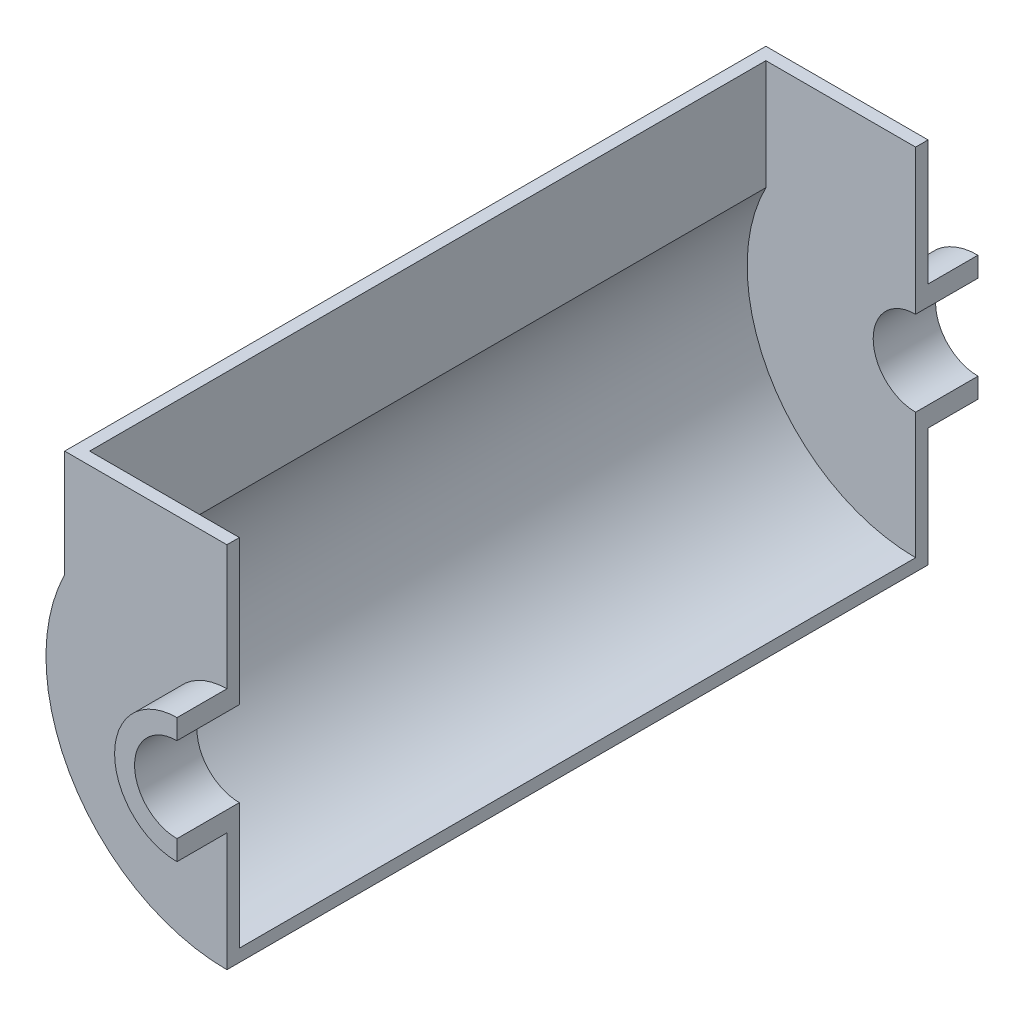
from build123d import *

# Parameters (mm, degrees)
BOSS_EXTRUDE1_DEPTH      = 20
BOSS_EXTRUDE1_DEPTH_BACK = 5
BOSS_EXTRUDE2_START      = -5
BOSS_EXTRUDE2_DEPTH      = 5
BOSS_EXTRUDE3_REACH      = 315.843


with BuildPart() as part:
    # Sketch1 → Boss-Extrude1 (new, two sides: drawn at the far end of the back side and taken through both)
    with BuildSketch(Plane.XY.offset(-BOSS_EXTRUDE1_DEPTH_BACK)):
        with BuildLine():
            Line((0, 25), (0, 17))
            ThreePointArc((0, 17), (-17, 0), (0, -17))
            Line((0, -17), (0, -25))
            ThreePointArc((0, -25), (-25, 0), (0, 25))
        make_face()
    extrude(amount=BOSS_EXTRUDE1_DEPTH + BOSS_EXTRUDE1_DEPTH_BACK)

    # Sketch2 → Boss-Extrude2 (add)
    with BuildSketch(Plane.XY.offset(BOSS_EXTRUDE2_START)):
        with BuildLine():
            Line((0, 25), (0, 75))
            Line((0, 75), (-65, 75))
            Line((-65, 75), (-65, 32.113081447))
            ThreePointArc((-65, 32.113081447), (-61.581037686, -38.262590053), (0, -72.5))
            Line((0, -72.5), (0, -25))
            ThreePointArc((0, -25), (-25, 0), (0, 25))
        make_face()
    extrude(amount=BOSS_EXTRUDE2_DEPTH)


with BuildPart() as body_2:
    # Mirror4: mirrored copy
    add(part.part.mirror(Plane.XY.offset(-140.5)))

    # Sketch3 → Boss-Extrude3 (add, up to next)
    with BuildSketch(Plane(origin=(0, 0, -5), x_dir=(-1, 0, 0), z_dir=(0, 0, -1)), mode=Mode.PRIVATE) as boss_extrude3_sk1:
        with BuildLine():
            Line((60, 75), (60, 30.923292192))
            ThreePointArc((60, 30.923292192), (57.634938288, -35.134938288), (0, -67.5))
            Line((0, -67.5), (0, -72.5))
            ThreePointArc((0, -72.5), (61.581037686, -38.262590053), (65, 32.113081447))
            Line((65, 32.113081447), (65, 75))
            Line((65, 75), (60, 75))
        make_face()
    boss_extrude3_tool1 = extrude(boss_extrude3_sk1.sketch, amount=BOSS_EXTRUDE3_REACH, mode=Mode.PRIVATE) - body_2.part

    add(part.part)  # Boss-Extrude3 merges part
    add(boss_extrude3_tool1.solids().sort_by_distance((-63.356452, 53.556541, -5))[0])


solid = body_2.part
